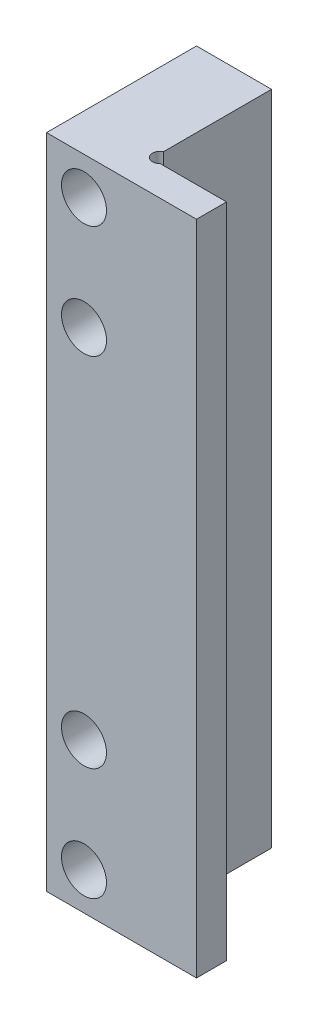
from build123d import *

# Parameters (mm, degrees)
SKETCH_1_W          = 10
SKETCH_1_H          = 43.8
EXTRUDE_1_DEPTH     = 10
SKETCH_2_R          = 0.5
SKETCH_2_W          = 5
SKETCH_2_H          = 8
CUT_EXTRUDE_1_DEPTH = 57.889805765
SKETCH_3_R          = 1.5
CUT_EXTRUDE_2_DEPTH = 43.398349024
SKETCH_4_R          = 1.5
CUT_EXTRUDE_3_DEPTH = 5


with BuildPart() as part:
    # 草圖1 → 填料-伸長1 (new body)
    with BuildSketch(Plane.XY):
        with Locations((-29.9, 0)):
            Rectangle(SKETCH_1_W, SKETCH_1_H)
    extrude(amount=-EXTRUDE_1_DEPTH)

    # 草圖2 → 除料-伸長1 (cut, through all)
    with BuildSketch(Plane.XZ.offset(21.9)):
        with Locations((-29.683988881, -2.34561779)):
            Circle(SKETCH_2_R)
        with Locations((-27.4, -6)):
            Rectangle(SKETCH_2_W, SKETCH_2_H)
    extrude(amount=-CUT_EXTRUDE_1_DEPTH, mode=Mode.SUBTRACT)

    # 草圖3 → 除料-伸長2 (cut, through all)
    with BuildSketch(Plane.XY):
        with Locations((-32.4, 19.4)):
            Circle(SKETCH_3_R)
        with Locations(Location((-32.4, -19.4, 0), (0, 0, 180))):
            Circle(SKETCH_3_R)
    extrude(amount=-CUT_EXTRUDE_2_DEPTH, mode=Mode.SUBTRACT)

    # 草圖4 → 除料-伸長3 (cut)
    with BuildSketch(Plane.XY):
        with Locations((-32.4, 11.9)):
            Circle(SKETCH_4_R)
        with Locations(Location((-32.4, -11.9, 0), (0, 0, 180))):
            Circle(SKETCH_4_R)
    extrude(amount=-CUT_EXTRUDE_3_DEPTH, mode=Mode.SUBTRACT)


solid = part.part
